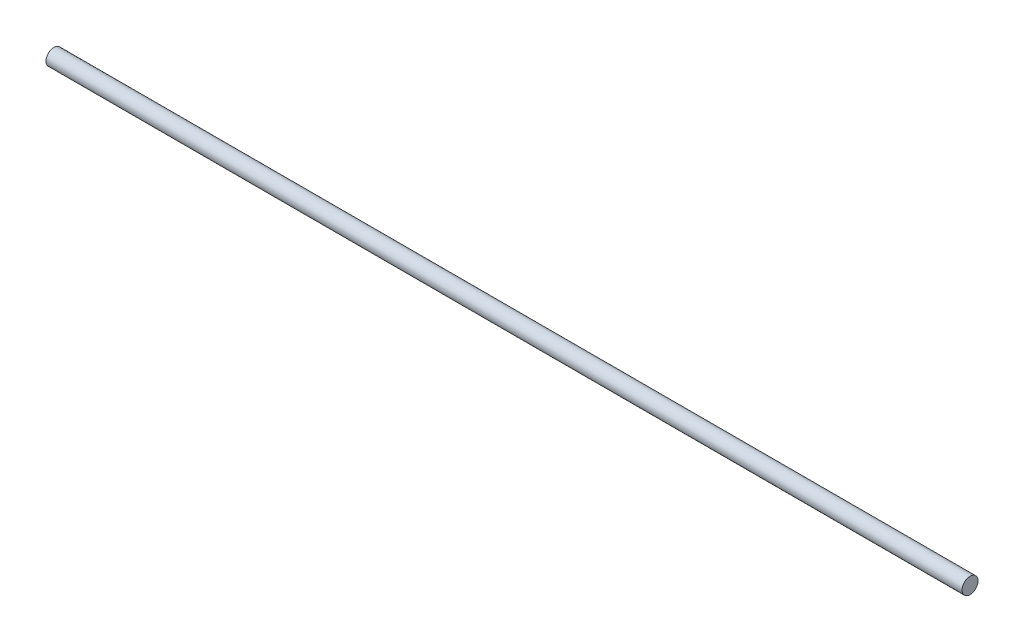
from build123d import *

# Parameters (mm, degrees)
SKETCH4_R           = 4
BOSS_EXTRUDE1_DEPTH = 460


with BuildPart() as part:
    # Sketch4 → Boss-Extrude1 (new body)
    with BuildSketch(Plane(origin=(0, 0, 0), x_dir=(0, 0, -1), z_dir=(1, 0, 0))):
        Circle(SKETCH4_R)
    extrude(amount=BOSS_EXTRUDE1_DEPTH)


solid = part.part
